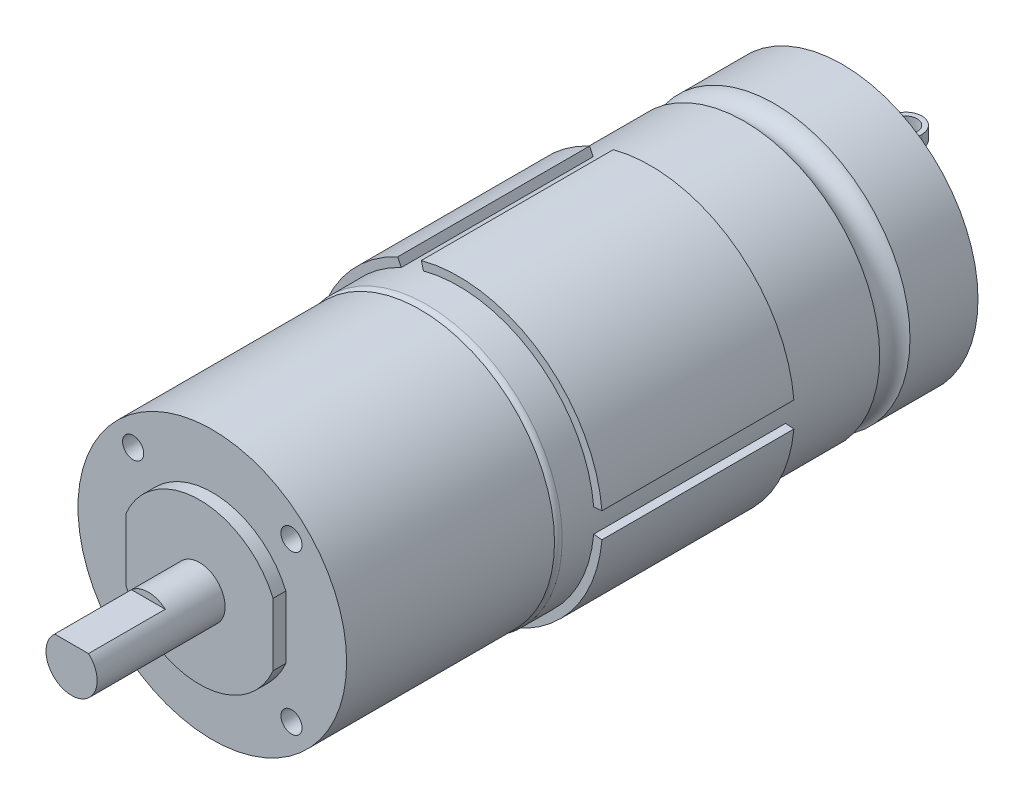
from build123d import *
from build123d.topology import SkipClean

# Parameters (mm, degrees)
SCHIZZO1_R                     = 21.2
ESTRUSIONE_ESTRUSIONE1_DEPTH   = 66
SCHIZZO2_R                     = 21
ESTRUSIONE_ESTRUSIONE2_DEPTH   = 32.5
SCHIZZO3_R                     = 12.5
ESTRUSIONE_ESTRUSIONE3_DEPTH   = 2
TAGLIO_ESTRUSIONE5_DEPTH       = 2
SCHIZZO5_R                     = 4
ESTRUSIONE_ESTRUSIONE4_DEPTH   = 20
TAGLIO_ESTRUSIONE6_DEPTH       = 12
SCHIZZO11_R                    = 8.64
ESTRUSIONE_ESTRUSIONE5_DEPTH   = 5
SCHIZZO12_W                    = 5
SCHIZZO12_H                    = 2
ESTRUSIONE_ESTRUSIONE6_DEPTH   = 7.42
SCHIZZO13_R                    = 1.75
TAGLIO_ESTRUSIONE4_DEPTH       = 16
RACCORDO2_R                    = 1
FORO_FILETTATO_M4_1_AT_2_COUNT = 2
FORO_FILETTATO_M4_1_AT_2_PITCH = 24.748737342
FORO_FILETTATO_M4_1_AT_3_COUNT = 2
FORO_FILETTATO_M4_1_AT_3_PITCH = 35
FORO_FILETTATO_M4_1_AT_4_COUNT = 2
FORO_FILETTATO_M4_1_AT_4_PITCH = 24.748737342
SCHIZZO19_R                    = 22.5
ESTRUSIONE_ESTRUSIONE7_DEPTH   = 30
TAGLIO_ESTRUSIONE9_START       = 30
TAGLIO_ESTRUSIONE9_DEPTH       = 30


with BuildPart() as part:
    # Schizzo1 → Estrusione-Estrusione1 (new body)
    with BuildSketch(Plane.XY):
        Circle(SCHIZZO1_R)
    extrude(amount=ESTRUSIONE_ESTRUSIONE1_DEPTH)

    # Schizzo9 → Taglia-Rivoluzione1 (revolve, cut)
    with BuildSketch(Plane(origin=(0, 0, 0), x_dir=(0, 0, -1), z_dir=(1, 0, 0)), mode=Mode.PRIVATE) as taglia_rivoluzione1_sk:
        with BuildLine():
            Line((-15.37, 21.2), (-10.63, 21.2))
            ThreePointArc((-10.63, 21.2), (-13, 19.495675813), (-15.37, 21.2))
        make_face()
    revolve(taglia_rivoluzione1_sk.sketch.rotate(Axis((0, 0, 0), (0, 0, 1)), 90), axis=Axis((0, 0, 0), (0, 0, 1)), mode=Mode.SUBTRACT)

    # Schizzo11 → Estrusione-Estrusione5 (add)
    with BuildSketch(Plane(origin=(0, 0, 0), x_dir=(-1, 0, 0), z_dir=(0, 0, -1))):
        Circle(SCHIZZO11_R)
    extrude(amount=ESTRUSIONE_ESTRUSIONE5_DEPTH)

    # Schizzo12 → Estrusione-Estrusione6 (add)
    with BuildSketch(Plane(origin=(0, 0, -5), x_dir=(-1, 0, 0), z_dir=(0, 0, -1))):
        with Locations((0, 7)):
            Rectangle(SCHIZZO12_W, SCHIZZO12_H)
        with Locations((0, -7)):
            Rectangle(SCHIZZO12_W, SCHIZZO12_H)
    extrude(amount=ESTRUSIONE_ESTRUSIONE6_DEPTH)

    # Schizzo13 → Taglio-Estrusione4 (cut)
    with BuildSketch(Plane(origin=(0, 8, 0), x_dir=(1, 0, 0), z_dir=(0, 1, 0))):
        with Locations(Location((0, 9.92, 0), (0, 0, 180))):
            Circle(SCHIZZO13_R)
        with BuildLine():
            Line((-2.5, 12.42), (-2.5, 9.92))
            ThreePointArc((-2.5, 9.92), (-1.767766953, 11.687766953), (0, 12.42))
            Line((0, 12.42), (-2.5, 12.42))
        make_face()
        with BuildLine():
            Line((2.5, 12.42), (0, 12.42))
            ThreePointArc((0, 12.42), (1.767766953, 11.687766953), (2.5, 9.92))
            Line((2.5, 9.92), (2.5, 12.42))
        make_face()
    extrude(amount=-TAGLIO_ESTRUSIONE4_DEPTH, mode=Mode.SUBTRACT)

    # Raccordo2
    raccordo2_edges = [part.edges().sort_by_distance(p)[0] for p in [
        (-21.2, 0, 66),
    ]]
    fillet(raccordo2_edges, radius=RACCORDO2_R)

    # Schizzo19 → Estrusione-Estrusione7 (add)
    with BuildSketch(Plane(origin=(0, 0, 60), x_dir=(-1, 0, 0), z_dir=(0, 0, -1))):
        Circle(SCHIZZO19_R)
    extrude(amount=ESTRUSIONE_ESTRUSIONE7_DEPTH)

    # Schizzo20 → Taglio-Estrusione9 (cut)
    with SkipClean():  # the faces are left unmerged after this step: merging them gives an invalid solid
        with BuildSketch(Plane(origin=(0, 0, 60), x_dir=(-1, 0, 0), z_dir=(0, 0, -1)).offset(TAGLIO_ESTRUSIONE9_START)):
            with BuildLine():
                Line((-22.414380707, 1.961004212), (-21.1193276, 1.847701746))
                ThreePointArc((-21.1193276, 1.847701746), (-21.2, 0), (-21.1193276, -1.847701746))
                Line((-21.1193276, -1.847701746), (-22.414380707, -1.961004212))
                ThreePointArc((-22.414380707, -1.961004212), (-22.5, 0), (-22.414380707, 1.961004212))
            make_face()
            with BuildLine():
                Line((9.508910889, 20.391925208), (8.959507149, 19.213725085))
                ThreePointArc((8.959507149, 19.213725085), (7.250827039, 19.921483561), (5.486963756, 20.477627517))
                Line((5.486963756, 20.477627517), (5.823428515, 21.733331092))
                ThreePointArc((5.823428515, 21.733331092), (7.695453225, 21.143083968), (9.508910889, 20.391925208))
            make_face()
            with BuildLine():
                Line((15.909902577, -15.909902577), (14.990663761, -14.990663761))
                ThreePointArc((14.990663761, -14.990663761), (16.240142194, -13.627097325), (17.366023339, -12.159820451))
                Line((17.366023339, -12.159820451), (18.430920996, -12.905469818))
                ThreePointArc((18.430920996, -12.905469818), (17.23599997, -14.462721218), (15.909902577, -15.909902577))
            make_face()
        extrude(amount=-TAGLIO_ESTRUSIONE9_DEPTH, mode=Mode.SUBTRACT)


with BuildPart() as body_2:
    # Schizzo2 → Estrusione-Estrusione2 (new body)
    with BuildSketch(Plane.XY.offset(66)):
        Circle(SCHIZZO2_R)
    extrude(amount=ESTRUSIONE_ESTRUSIONE2_DEPTH)

    # Schizzo3 → Estrusione-Estrusione3 (add)
    with BuildSketch(Plane.XY.offset(98.5)):
        Circle(SCHIZZO3_R)
    extrude(amount=ESTRUSIONE_ESTRUSIONE3_DEPTH)

    # Schizzo4 → Taglio-Estrusione5 (cut)
    with BuildSketch(Plane.XY.offset(100.5)):
        with BuildLine():
            Line((-11.5, 4.898979486), (-11.5, -4.898979486))
            ThreePointArc((-11.5, -4.898979486), (-12.5, 0), (-11.5, 4.898979486))
        make_face()
        with BuildLine():
            Line((11.5, 4.898979486), (11.5, -4.898979486))
            ThreePointArc((11.5, -4.898979486), (12.5, 0), (11.5, 4.898979486))
        make_face()
    extrude(amount=-TAGLIO_ESTRUSIONE5_DEPTH, mode=Mode.SUBTRACT)

    # Schizzo5 → Estrusione-Estrusione4 (add)
    with BuildSketch(Plane.XY.offset(100.5)):
        Circle(SCHIZZO5_R)
    extrude(amount=ESTRUSIONE_ESTRUSIONE4_DEPTH)

    # Schizzo6 → Taglio-Estrusione6 (cut)
    with BuildSketch(Plane.XY.offset(120.5)):
        with BuildLine():
            Line((-2.645751311, 3), (2.645751311, 3))
            ThreePointArc((2.645751311, 3), (0, 4), (-2.645751311, 3))
        make_face()
    extrude(amount=-TAGLIO_ESTRUSIONE6_DEPTH, mode=Mode.SUBTRACT)

    # Schizzo18 → Foro filettato M4-1 (revolve, cut)
    with BuildSketch(Plane(origin=(-12.374368671, 12.374368671, 98.5), x_dir=(0, -1, 0), z_dir=(1, 0, 0))):
        Polygon((0, 0), (0, 12.491420021), (1.65, 11.5), (1.65, 0), align=None)
    foro_filettato_m4_1 = revolve(axis=Axis((-12.374368671, 12.374368671, 104.85), (0, 0, -1)), mode=Mode.SUBTRACT)

    # Foro filettato M4-1 at 2: Foro filettato M4-1 ×2
    with Locations(*[(i * FORO_FILETTATO_M4_1_AT_2_PITCH, 0, 0) for i in range(1, FORO_FILETTATO_M4_1_AT_2_COUNT)]):
        add(foro_filettato_m4_1, mode=Mode.SUBTRACT)

    # Foro filettato M4-1 at 3: Foro filettato M4-1 ×2
    with Locations(*[Vector(0.7071067811865489, -0.7071067811865462, 0) * (i * FORO_FILETTATO_M4_1_AT_3_PITCH) for i in range(1, FORO_FILETTATO_M4_1_AT_3_COUNT)]):
        add(foro_filettato_m4_1, mode=Mode.SUBTRACT)

    # Foro filettato M4-1 at 4: Foro filettato M4-1 ×2
    with Locations(*[(0, -i * FORO_FILETTATO_M4_1_AT_4_PITCH, 0) for i in range(1, FORO_FILETTATO_M4_1_AT_4_COUNT)]):
        add(foro_filettato_m4_1, mode=Mode.SUBTRACT)


solid = Compound([part.part, body_2.part])
